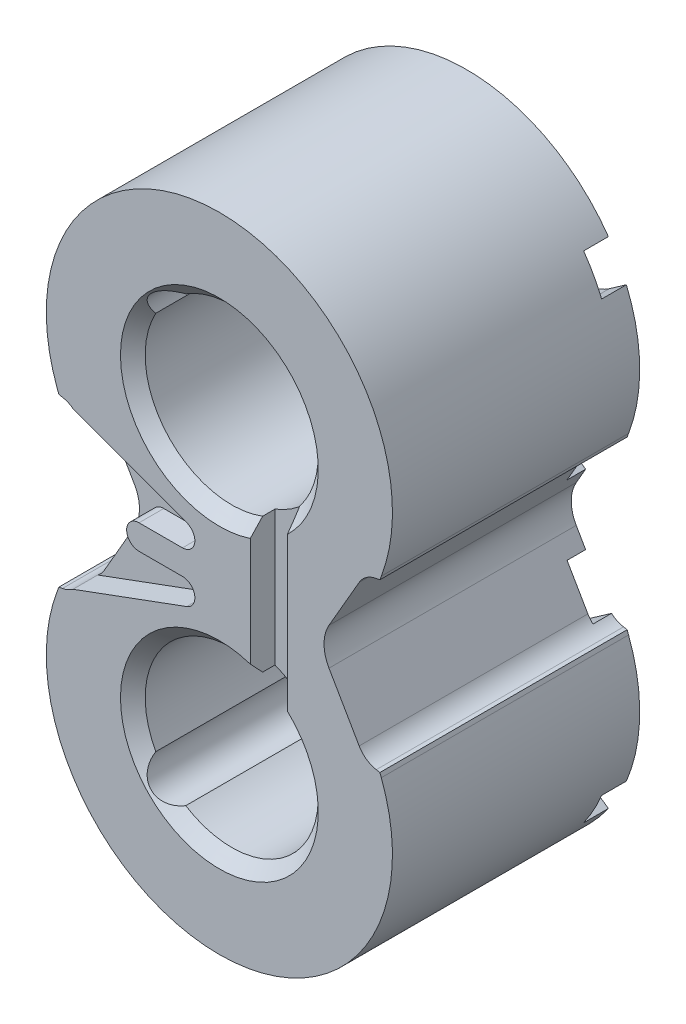
from build123d import *

# Parameters (mm, degrees)
BOSS_EXTRU_1_DEPTH       = 20
ESQUISSE2_R              = 7
ENL_V_MAT_EXTRU_1_DEPTH  = 36.665109
CHANFREIN1_SIZE          = 1
ENL_V_MAT_EXTRU_3_DEPTH  = 36.665109
CONG_1_R                 = 20
ENL_V_MAT_EXTRU_4_DEPTH  = 36.665109168
CONG_2_R                 = 3
CONG_3_R                 = 2
CONG_2_OF_SYM_TRIE1_R    = 3
CONG_3_OF_SYM_TRIE1_R    = 2
ESQUISSE7_W              = 3
ESQUISSE7_H              = 19.363772413
ENL_V_MAT_EXTRU_5_DEPTH  = 2
ESQUISSE8_R              = 2
ENL_V_MAT_EXTRU_6_DEPTH  = 36.665109168
ENL_V_MAT_EXTRU_7_DEPTH  = 2
ENL_V_MAT_EXTRU_8_DEPTH  = 1
ENL_V_MAT_EXTRU_9_DEPTH  = 2
ENL_V_MAT_EXTRU_10_DEPTH = 0.5


with BuildPart() as part:
    # Esquisse1 → Boss.-Extru.1 (new body)
    with BuildSketch(Plane.XY):
        with BuildLine():
            Line((-14, -12), (-14, 12))
            ThreePointArc((-14, 12), (0, 26), (14, 12))
            Line((14, 12), (14, -12))
            ThreePointArc((14, -12), (0, -26), (-14, -12))
        make_face()
    extrude(amount=BOSS_EXTRU_1_DEPTH)

    # Esquisse2 → Enlèv. mat.-Extru.1 (cut, through all)
    with BuildSketch(Plane.XY.offset(20)):
        with Locations((0, 12)):
            Circle(ESQUISSE2_R)
        with Locations((0, -12)):
            Circle(ESQUISSE2_R)
    extrude(amount=-ENL_V_MAT_EXTRU_1_DEPTH, mode=Mode.SUBTRACT)

    # Chanfrein1
    chanfrein1_edges = [part.edges().sort_by_distance(p)[0] for p in [
        (-7, 12, 20),
        (-7, -12, 20),
    ]]
    chamfer(chanfrein1_edges, length=CHANFREIN1_SIZE)

    # Esquisse3 → Enlèv. mat.-Extru.3 (cut, through all)
    with BuildSketch(Plane.XY.offset(20)):
        with BuildLine():
            Line((-14, 12), (-14, -12))
            ThreePointArc((-14, -12), (-12.185143325, -5.106359297), (-7.211102551, 0))
            ThreePointArc((-7.211102551, 0), (-12.185143325, 5.106359297), (-14, 12))
        make_face()
        with BuildLine():
            Line((14, -12), (14, 12))
            ThreePointArc((14, 12), (12.185143325, 5.106359297), (7.211102551, 0))
            ThreePointArc((7.211102551, 0), (12.185143325, -5.106359297), (14, -12))
        make_face()
    extrude(amount=-ENL_V_MAT_EXTRU_3_DEPTH, mode=Mode.SUBTRACT)

    # Congé1
    cong_1_edges = [part.edges().sort_by_distance(p)[0] for p in [
        (7.211102551, 0, 10),
        (-7.211102551, 0, 10),
    ]]
    fillet(cong_1_edges, radius=CONG_1_R)

    # Esquisse6 → Enlèv. mat.-Extru.4 (cut, through all)
    with BuildSketch(Plane.XY.offset(20)):
        Polygon((-12.985436878, 6.75), (-11.773762969, 6.536349198), (-8, 0), (-11.773762969, -6.536349198), (-12.985436878, -6.75), align=None)
    enl_v_mat_extru_4 = extrude(amount=-ENL_V_MAT_EXTRU_4_DEPTH, mode=Mode.SUBTRACT)

    # Congé2
    cong_2_edges = [part.edges().sort_by_distance(p)[0] for p in [
        (-8, 0, 10),
    ]]
    fillet(cong_2_edges, radius=CONG_2_R)

    # Congé3
    cong_3_edges = [part.edges().sort_by_distance(p)[0] for p in [
        (-11.773762969, 6.536349198, 10),
        (-11.773762969, -6.536349198, 10),
    ]]
    fillet(cong_3_edges, radius=CONG_3_R)

    # Symétrie1: Enlèv. mat.-Extru.4 across plane
    add(enl_v_mat_extru_4.mirror(Plane(origin=(0, 0, 0), x_dir=(0, 0, 1), z_dir=(1, 0, 0))), mode=Mode.SUBTRACT)

    # Congé2 of Symétrie1
    cong_2_of_sym_trie1_edges = [part.edges().sort_by_distance(p)[0] for p in [
        (8, 0, 10),
    ]]
    fillet(cong_2_of_sym_trie1_edges, radius=CONG_2_OF_SYM_TRIE1_R)

    # Congé3 of Symétrie1
    cong_3_of_sym_trie1_edges = [part.edges().sort_by_distance(p)[0] for p in [
        (11.773762969, 6.536349198, 10),
        (11.773762969, -6.536349198, 10),
    ]]
    fillet(cong_3_of_sym_trie1_edges, radius=CONG_3_OF_SYM_TRIE1_R)

    # Esquisse7 → Enlèv. mat.-Extru.5 (cut)
    with BuildSketch(Plane.XY.offset(20)):
        with Locations((4, -0.240073956)):
            Rectangle(ESQUISSE7_W, ESQUISSE7_H)
    extrude(amount=-ENL_V_MAT_EXTRU_5_DEPTH, mode=Mode.SUBTRACT)

    # Esquisse8 → Enlèv. mat.-Extru.6 (cut, through all)
    with BuildSketch(Plane.XY.offset(20)):
        with Locations((-4.25, 16)):
            Circle(ESQUISSE8_R)
        with Locations((-4.25, -16)):
            Circle(ESQUISSE8_R)
    extrude(amount=-ENL_V_MAT_EXTRU_6_DEPTH, mode=Mode.SUBTRACT)

    # Esquisse9 → Enlèv. mat.-Extru.7 (cut)
    with BuildSketch(Plane.XY.offset(20)):
        with BuildLine():
            Line((-12.985436878, 6.75), (-2.638783858, 2.938351237))
            ThreePointArc((-2.638783858, 2.938351237), (-2, 1.824431263), (-2.984467175, 1))
            Line((-2.984467175, 1), (-6.5, 1))
            ThreePointArc((-6.5, 1), (-7.5, 0), (-6.5, -1))
            Line((-6.5, -1), (-2.984467175, -1))
            ThreePointArc((-2.984467175, -1), (-2, -1.824431263), (-2.638783858, -2.938351237))
            Line((-2.638783858, -2.938351237), (-12.985436878, -6.75))
            Line((-12.985436878, -6.75), (-12.985436878, 6.75))
        make_face()
    extrude(amount=-ENL_V_MAT_EXTRU_7_DEPTH, mode=Mode.SUBTRACT)

    # Esquisse10 → Enlèv. mat.-Extru.8 (cut)
    with BuildSketch(Plane(origin=(0, 0, 0), x_dir=(-1, 0, 0), z_dir=(0, 0, -1))):
        Polygon((-14.880645038, 4.022009348), (-5.050820507, 10.904926585), (-2.756514761, 7.628318408), (-12.586339293, 0.745401171), align=None)
        Polygon((14.104417015, 2.702110502), (8.18518219, 6.119582321), (9.18518219, 7.851633128), (15.104417015, 4.434161309), align=None)
    enl_v_mat_extru_8 = extrude(amount=-ENL_V_MAT_EXTRU_8_DEPTH, mode=Mode.SUBTRACT)

    # Symétrie2: Enlèv. mat.-Extru.8 across plane
    add(enl_v_mat_extru_8.mirror(Plane.ZX), mode=Mode.SUBTRACT)

    # Esquisse11 → Enlèv. mat.-Extru.9 (cut)
    with BuildSketch(Plane(origin=(0, 0, 0), x_dir=(-1, 0, 0), z_dir=(0, 0, -1))):
        with BuildLine():
            Line((-9.821287991, 18.876939886), (-11.46812862, 20.030070109))
            Line((-11.46812862, 20.030070109), (-13.322410066, 19.286515908))
            Line((-13.322410066, 19.286515908), (-12.922465041, 17.386083667))
            Line((-12.922465041, 17.386083667), (-11.5420173, 16.419483753))
            ThreePointArc((-11.5420173, 16.419483753), (-8.998687611, 15.827772592), (-6.753604006, 17.161282102))
            ThreePointArc((-6.753604006, 17.161282102), (7.619740739, 15.766902052), (0, 3.5))
            ThreePointArc((0, 3.5), (-2.474873734, 2.474873734), (-3.5, 0))
            Line((-3.5, 0), (-0.5, 0))
            ThreePointArc((-0.5, 0), (-0.353553391, 0.353553391), (0, 0.5))
            ThreePointArc((0, 0.5), (10.309061, 17.096396894), (-9.137228949, 18.982911079))
            ThreePointArc((-9.137228949, 18.982911079), (-9.457955178, 18.79240972), (-9.821287991, 18.876939886))
        make_face()
    enl_v_mat_extru_9 = extrude(amount=-ENL_V_MAT_EXTRU_9_DEPTH, mode=Mode.SUBTRACT)

    # Esquisse12 → Enlèv. mat.-Extru.10 (cut)
    with BuildSketch(Plane(origin=(0, 0, 1), x_dir=(-1, 0, 0), z_dir=(0, 0, -1))):
        Polygon((-11.722201386, 6.233575403), (-6.642191838, 9.790636383), (-4.347886092, 6.514028206), (-9.626796974, 2.817695012), align=None)
        Polygon((-9.626796974, -2.817695012), (-4.347886092, -6.514028206), (-6.642191838, -9.790636383), (-11.722201386, -6.233575403), align=None)
    extrude(amount=-ENL_V_MAT_EXTRU_10_DEPTH, mode=Mode.SUBTRACT)

    # Symétrie3: Enlèv. mat.-Extru.9 across plane
    add(enl_v_mat_extru_9.mirror(Plane.ZX), mode=Mode.SUBTRACT)


solid = part.part
